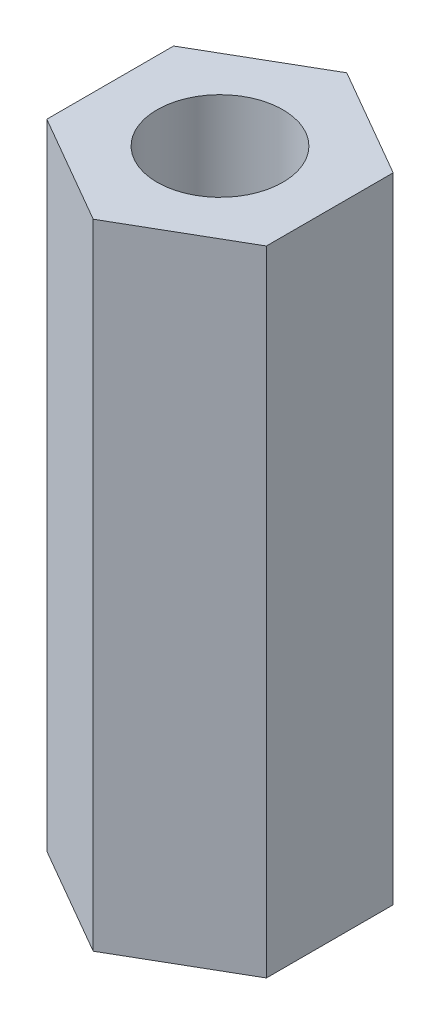
from build123d import *

# Parameters (mm, degrees)
SKETCH2_R           = 7.9375
BOSS_EXTRUDE1_DEPTH = 80


with BuildPart() as part:
    # Sketch2 → Boss-Extrude1 (new body)
    with BuildSketch(Plane(origin=(0, 0, 0), x_dir=(1, 0, 0), z_dir=(0, 1, 0))):
        Polygon((0, 16), (-13.856406461, 8), (-13.856406461, -8), (0, -16), (13.856406461, -8), (13.856406461, 8), align=None)
        with Locations(Location((0, 0, 0), (0, 0, 270))):
            Circle(SKETCH2_R, mode=Mode.SUBTRACT)
    extrude(amount=BOSS_EXTRUDE1_DEPTH)


solid = part.part
